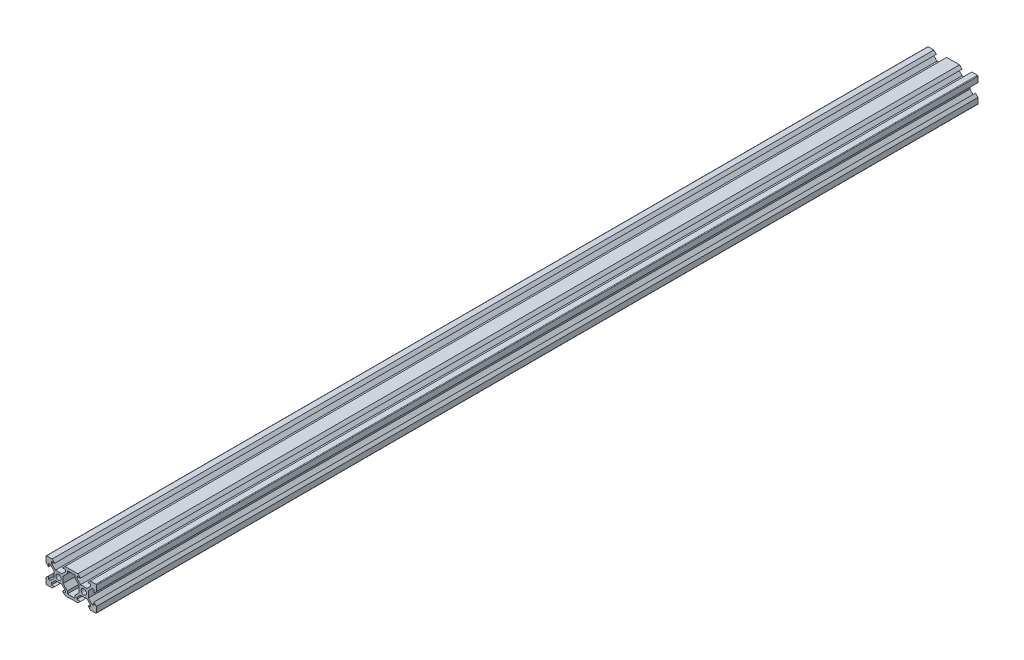
from build123d import *

# Parameters (mm, degrees)
SKETCH1_R           = 2.1
BOSS_EXTRUDE1_DEPTH = 700
FILLET1_R           = 0.5


with BuildPart() as part:
    # Sketch1 → Boss-Extrude1 (new body)
    with BuildSketch(Plane.XY):
        Polygon((-20, -10), (-15.5, -10), (-15.1, -10), (-13.1, -8), (-15.5, -8), (-15.5, -6.560660172), (-12.539339828, -3.6), (-7.460660172, -3.6), (-4.5, -6.560660172), (-4.5, -8), (-6.9, -8), (-4.9, -10), (5.313777138, -10), (7.313777138, -8), (4.5, -8), (4.5, -6.560660172), (7.460660172, -3.6), (12.539339828, -3.6), (15.5, -6.560660172), (15.5, -8), (13.513777138, -8), (15.1, -10), (15.5, -10), (20, -10), (20, -5.5), (20, -5.1), (18, -3.1), (18, -5.5), (16.560660172, -5.5), (13.6, -2.539339828), (13.6, 2.539339828), (16.560660172, 5.5), (18, 5.5), (18, 3.1), (20, 5.1), (20, 5.5), (20, 10), (15.5, 10), (15.1, 10), (13.1, 8), (15.5, 8), (15.5, 6.560660172), (12.539339828, 3.6), (7.460660172, 3.6), (4.5, 6.560660172), (4.5, 8), (7.313777138, 8), (5.313777138, 10), (-4.9, 10), (-6.9, 8), (-4.5, 8), (-4.5, 6.560660172), (-7.460660172, 3.6), (-12.539339828, 3.6), (-15.5, 6.560660172), (-15.5, 8), (-13.1, 8), (-15.1, 10), (-15.5, 10), (-20, 10), (-20, 5.5), (-20, 5.1), (-18, 3.1), (-18, 5.5), (-16.560660172, 5.5), (-13.6, 2.539339828), (-13.6, -2.539339828), (-16.560660172, -5.5), (-18, -5.5), (-18, -3.1), (-20, -5.1), (-20, -5.5), align=None)
        with Locations((-10, 0)):
            Circle(SKETCH1_R, mode=Mode.SUBTRACT)
        with Locations((10, 0)):
            Circle(SKETCH1_R, mode=Mode.SUBTRACT)
        Polygon((3, -5.939339828), (3, -8), (-3, -8), (-3, -5.939339828), (-6.4, -2.539339828), (-6.4, 2.539339828), (-3, 5.939339828), (-3, 8), (3, 8), (3, 5.939339828), (6.4, 2.539339828), (6.4, -2.539339828), align=None, mode=Mode.SUBTRACT)
    extrude(amount=BOSS_EXTRUDE1_DEPTH)

    # Fillet1
    fillet1_edges = [part.edges().sort_by_distance(p)[0] for p in [
        (-20, 10, 350),
        (20, 10, 350),
        (20, -10, 350),
        (-20, -10, 350),
    ]]
    fillet(fillet1_edges, radius=FILLET1_R)


solid = part.part
